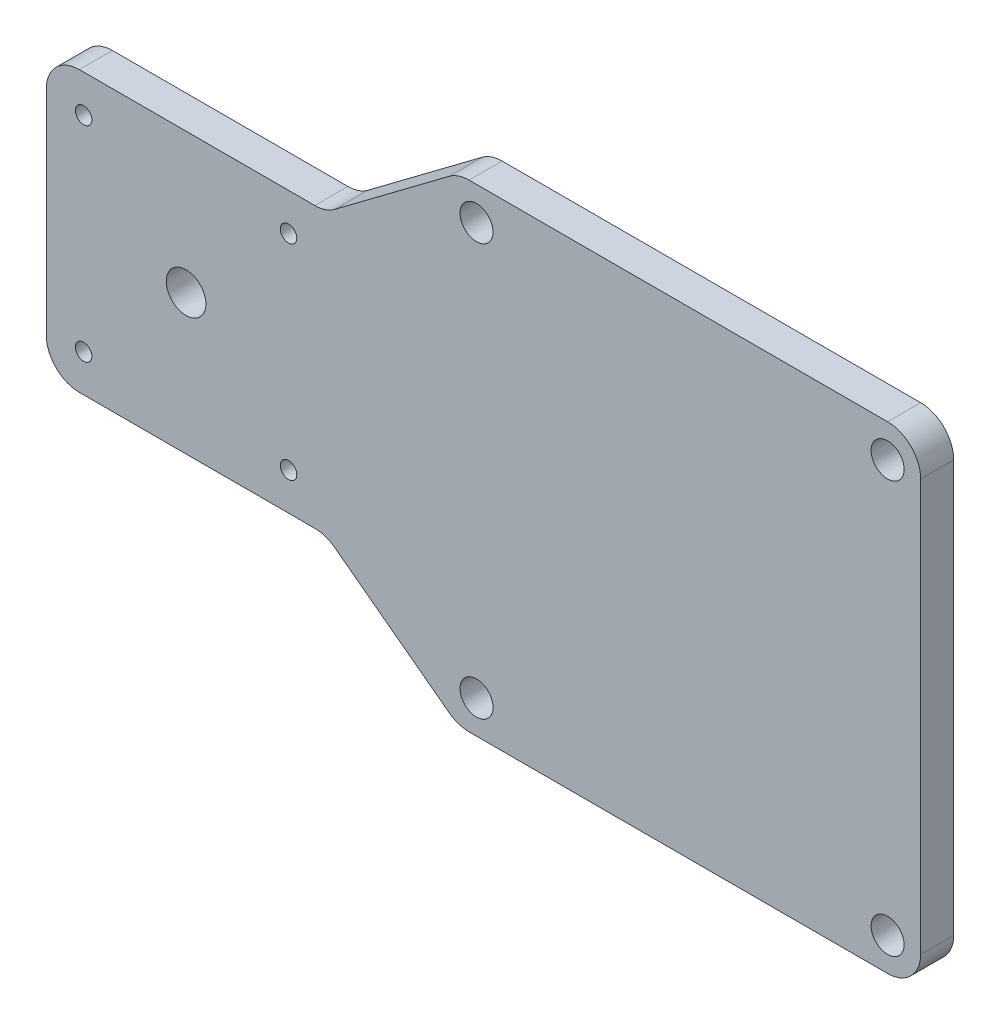
from build123d import *

# Parameters (mm, degrees)
BOSS_EXTRUDE1_DEPTH = 5
FILLET2_R           = 5
FILLET3_R           = 5
FILLET4_R           = 5
FILLET5_R           = 5
FILLET6_R           = 5
FILLET7_R           = 5
FILLET8_R           = 5
FILLET9_R           = 5
SKETCH2_R           = 1.25
SKETCH2_R_2         = 2.5
SKETCH2_R_3         = 3
CUT_EXTRUDE1_DEPTH  = 10


with BuildPart() as part:
    # Sketch1 → Boss-Extrude1 (new body)
    with BuildSketch(Plane.XY):
        Polygon((21.15, 21.15), (41.15, 36.15), (111.15, 36.15), (111.15, -36.15), (41.15, -36.15), (21.15, -21.15), (-21.15, -21.15), (-21.15, 21.15), align=None)
    extrude(amount=BOSS_EXTRUDE1_DEPTH)

    # Fillet2
    fillet2_edges = [part.edges().sort_by_distance(p)[0] for p in [
        (-21.15, -21.15, 2.5),
    ]]
    fillet(fillet2_edges, radius=FILLET2_R)

    # Fillet3
    fillet3_edges = [part.edges().sort_by_distance(p)[0] for p in [
        (-21.15, 21.15, 2.5),
    ]]
    fillet(fillet3_edges, radius=FILLET3_R)

    # Fillet4
    fillet4_edges = [part.edges().sort_by_distance(p)[0] for p in [
        (21.15, 21.15, 2.5),
    ]]
    fillet(fillet4_edges, radius=FILLET4_R)

    # Fillet5
    fillet5_edges = [part.edges().sort_by_distance(p)[0] for p in [
        (21.15, -21.15, 2.5),
    ]]
    fillet(fillet5_edges, radius=FILLET5_R)

    # Fillet6
    fillet6_edges = [part.edges().sort_by_distance(p)[0] for p in [
        (41.15, -36.15, 2.5),
    ]]
    fillet(fillet6_edges, radius=FILLET6_R)

    # Fillet7
    fillet7_edges = [part.edges().sort_by_distance(p)[0] for p in [
        (41.15, 36.15, 2.5),
    ]]
    fillet(fillet7_edges, radius=FILLET7_R)

    # Fillet8
    fillet8_edges = [part.edges().sort_by_distance(p)[0] for p in [
        (111.15, 36.15, 2.5),
    ]]
    fillet(fillet8_edges, radius=FILLET8_R)

    # Fillet9
    fillet9_edges = [part.edges().sort_by_distance(p)[0] for p in [
        (111.15, -36.15, 2.5),
    ]]
    fillet(fillet9_edges, radius=FILLET9_R)

    # Sketch2 → Cut-Extrude1 (cut)
    with BuildSketch(Plane.XY.offset(5)):
        with Locations((-15.5, -15.5)):
            Circle(SKETCH2_R)
        with Locations((-15.5, 15.5)):
            Circle(SKETCH2_R)
        with Locations((15.5, 15.5)):
            Circle(SKETCH2_R)
        with Locations((15.5, -15.5)):
            Circle(SKETCH2_R)
        with Locations((106.15, 31.15)):
            Circle(SKETCH2_R_2)
        with Locations((106.15, -31.15)):
            Circle(SKETCH2_R_2)
        with Locations((43.95, -31.15)):
            Circle(SKETCH2_R_2)
        with Locations((43.95, 31.15)):
            Circle(SKETCH2_R_2)
        Circle(SKETCH2_R_3)
    extrude(amount=-CUT_EXTRUDE1_DEPTH, mode=Mode.SUBTRACT)


solid = part.part
